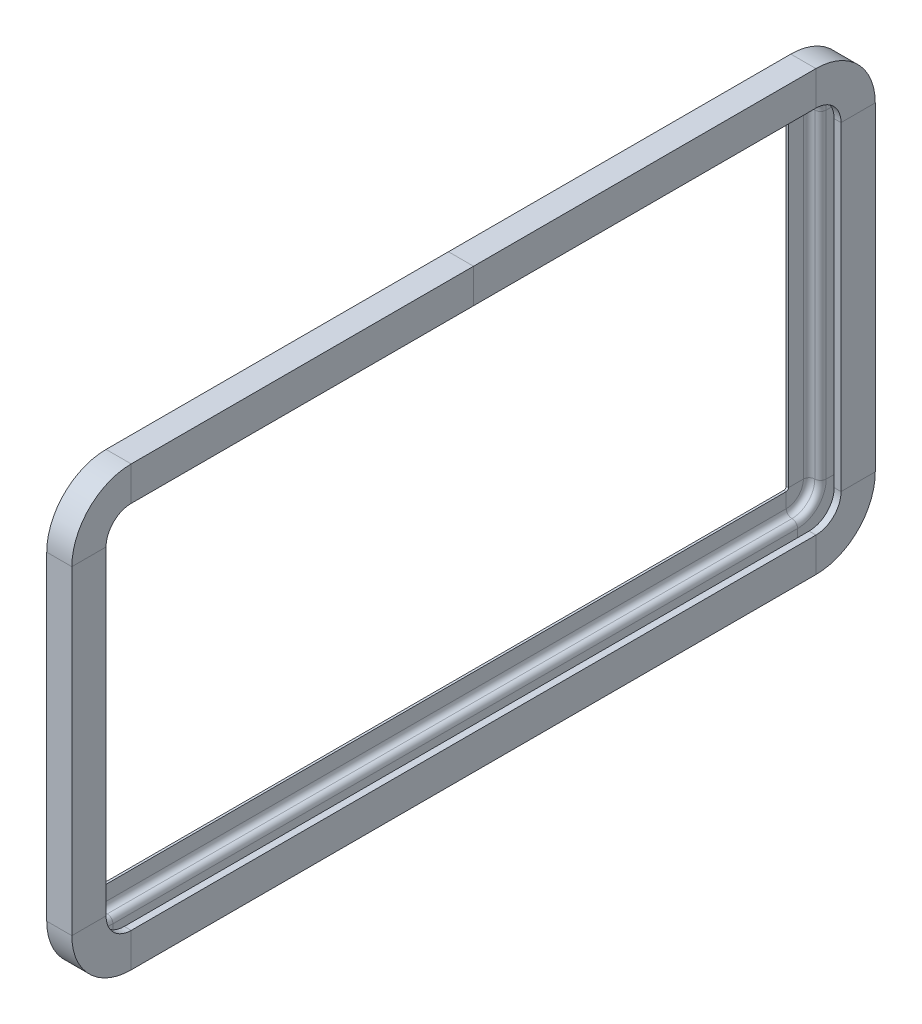
from build123d import *


with BuildPart() as part:
    # Sweep1: sweep along a path in Sketch2
    with BuildLine(Plane(origin=(2.5, 0, 0), x_dir=(0, 0, -1), z_dir=(1, 0, 0))) as sweep1_path:
        Line((150, 92), (-150, 92))
        ThreePointArc((-150, 92), (-165.556349186, 85.556349186), (-172, 70))
        Line((-172, 70), (-172, -70))
        ThreePointArc((-172, -70), (-165.556349186, -85.556349186), (-150, -92))
        Line((-150, -92), (150, -92))
        ThreePointArc((150, -92), (165.556349186, -85.556349186), (172, -70))
        Line((172, -70), (172, 70))
        ThreePointArc((172, 70), (165.556349186, 85.556349186), (150, 92))
    # Sketch1 → Sweep1 (sweep)
    with BuildSketch(Plane.XY):
        with BuildLine():
            Line((5, 81), (5, 89.5))
            ThreePointArc((5, 89.5), (4.267766953, 91.267766953), (2.5, 92))
            ThreePointArc((2.5, 92), (0.732233047, 91.267766953), (0, 89.5))
            Line((0, 89.5), (0, 82.5))
            ThreePointArc((0, 82.5), (-0.732233047, 80.732233047), (-2.5, 80))
            ThreePointArc((-2.5, 80), (-4.267766953, 79.267766953), (-5, 77.5))
            Line((-5, 77.5), (-5, 71))
            Line((-5, 71), (-6, 71))
            Line((-6, 71), (-6, 81))
            Line((-6, 81), (-3, 81))
            Line((-3, 81), (-3, 96))
            Line((-3, 96), (8, 96))
            Line((8, 96), (8, 81))
            Line((8, 81), (5, 81))
        make_face()
    sweep(path=sweep1_path.line)


solid = part.part
